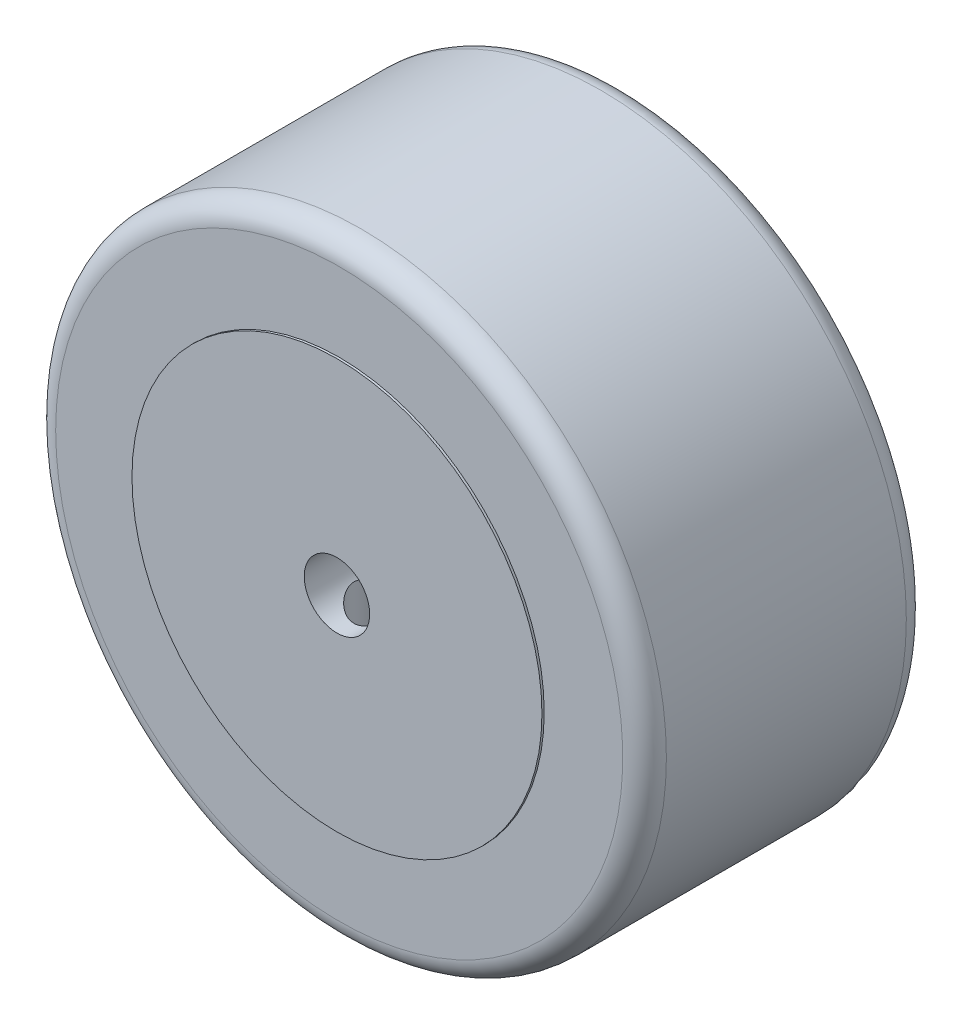
from build123d import *

# Parameters (mm, degrees)
F_3_0_3_DIAMETER_HOLE1_D = 3
SKETCH4_W                = 1.1303
SKETCH4_H                = 23.398


with BuildPart() as part:
    # Sketch1 → Revolve1 (revolve)
    with BuildSketch(Plane(origin=(0, 0, 0), x_dir=(0, 0, -1), z_dir=(1, 0, 0))):
        Polygon((0, 0), (0, 9.398), (1.524, 9.398), (1.524, 8.382), (5.842, 8.382), (5.842, 10.16), (7.366, 10.16), (7.366, 8.382), (11.684, 8.382), (11.684, 9.398), (13.208, 9.398), (13.208, 7.493), (4.318, 7.493), (4.318, 0), align=None)
    revolve(axis=Axis((0, 0, -13.776427276), (0, 0, 1)))

    # Ø3.0 (3) Diameter Hole1 (through all)
    with Locations(Plane.XY):
        with Locations((0, 0)):
            Hole(F_3_0_3_DIAMETER_HOLE1_D / 2)

    # Sketch4 → #4-40 Tapped Hole1 (revolve, cut)
    with BuildSketch(Plane(origin=(0, 9.398, -1.905), x_dir=(0, 0, 1), z_dir=(1, 0, 0))):
        with Locations((0.56515, 11.699)):
            Rectangle(SKETCH4_W, SKETCH4_H)
    revolve(axis=Axis((0, 15.748, -1.905), (0, -1, 0)), mode=Mode.SUBTRACT)


with BuildPart() as body_2:
    # Sketch5 → Revolve2 (revolve)
    with BuildSketch(Plane(origin=(0, 0, 0), x_dir=(0, 0, -1), z_dir=(1, 0, 0)), mode=Mode.PRIVATE) as revolve2_sk:
        with BuildLine():
            Line((1.104, 14), (12.104, 14))
            ThreePointArc((12.104, 14), (12.811106781, 13.707106781), (13.104, 13))
            Line((13.104, 13), (13.104, 8))
            Line((13.104, 8), (0.104, 8))
            Line((0.104, 8), (0.104, 13))
            ThreePointArc((0.104, 13), (0.396893219, 13.707106781), (1.104, 14))
        make_face()
    revolve(revolve2_sk.sketch.rotate(Axis((0, 0, -80.9), (0, 0, 1)), 90), axis=Axis((0, 0, -80.9), (0, 0, 1)))


solid = Compound([part.part, body_2.part])
